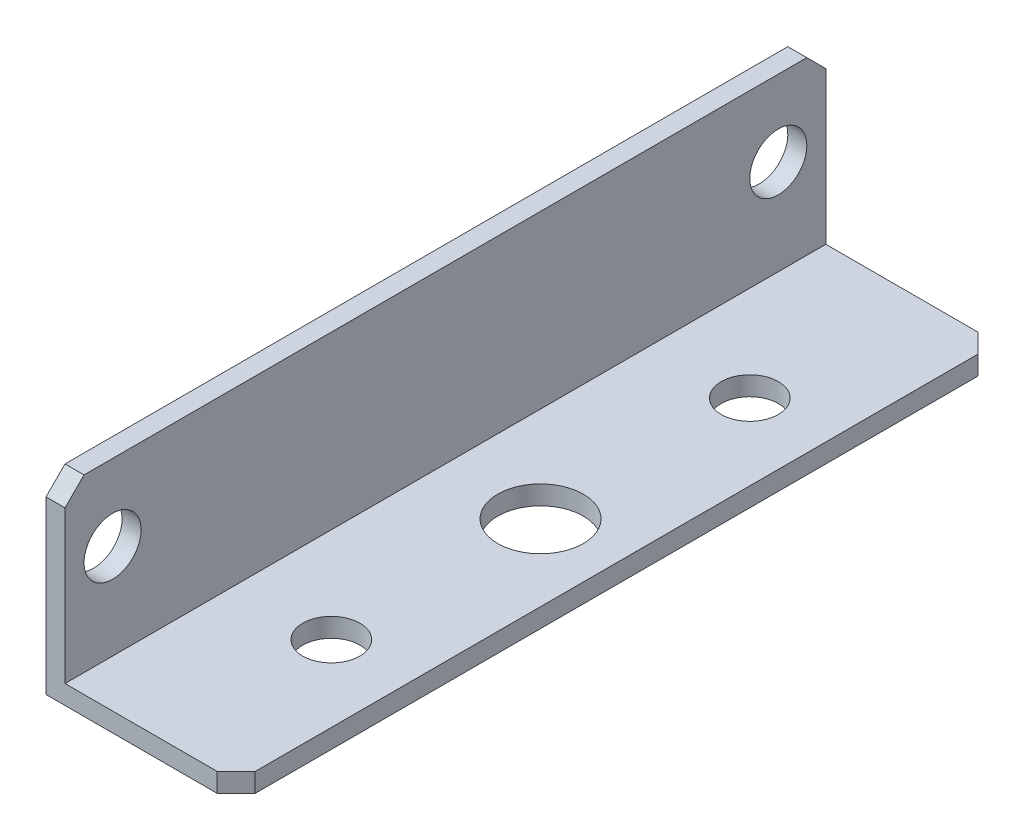
from build123d import *

# Parameters (mm, degrees)
LINEAR_AUSTRAGEN_D_NN1_DEPTH    = 20
FASE1_SIZE                      = 1
SKIZZE2_R                       = 1.5
SCHNITT_LINEAR_AUSTRAGEN1_DEPTH = 10
SKIZZE3_R                       = 1.5
SCHNITT_LINEAR_AUSTRAGEN2_DEPTH = 10
SKIZZE4_R                       = 2.25
SCHNITT_LINEAR_AUSTRAGEN3_DEPTH = 10


with BuildPart() as part:
    # Skizze1 → Linear-Austragen-Dünn1 (new, symmetric)
    with BuildSketch(Plane.XY):
        Polygon((0, 10), (0, 0), (10, 0), (10, 1), (1, 1), (1, 10), align=None)
    extrude(amount=LINEAR_AUSTRAGEN_D_NN1_DEPTH, both=True)

    # Fase1
    fase1_edges = [part.edges().sort_by_distance(p)[0] for p in [
        (0.5, 10, 20),
        (0.5, 10, -20),
        (10, 0.5, -20),
        (10, 0.5, 20),
    ]]
    chamfer(fase1_edges, length=FASE1_SIZE)

    # Skizze2 → Schnitt-Linear austragen1 (cut)
    with BuildSketch(Plane(origin=(1, 0, 0), x_dir=(0, 0, -1), z_dir=(1, 0, 0))):
        with Locations(Location((-17.5, 6, 0), (0, 0, 90))):
            Circle(SKIZZE2_R)
        with Locations(Location((17.5, 6, 0), (0, 0, 90))):
            Circle(SKIZZE2_R)
    extrude(amount=-SCHNITT_LINEAR_AUSTRAGEN1_DEPTH, mode=Mode.SUBTRACT)

    # Skizze3 → Schnitt-Linear austragen2 (cut)
    with BuildSketch(Plane(origin=(0, 1, 0), x_dir=(1, 0, 0), z_dir=(0, 1, 0))):
        with Locations(Location((6, -11, 0), (0, 0, 270))):
            Circle(SKIZZE3_R)
        with Locations(Location((6, 11, 0), (0, 0, 270))):
            Circle(SKIZZE3_R)
    extrude(amount=-SCHNITT_LINEAR_AUSTRAGEN2_DEPTH, mode=Mode.SUBTRACT)

    # Skizze4 → Schnitt-Linear austragen3 (cut)
    with BuildSketch(Plane(origin=(0, 1, 0), x_dir=(1, 0, 0), z_dir=(0, 1, 0))):
        with Locations(Location((6, 0, 0), (0, 0, 270))):
            Circle(SKIZZE4_R)
    extrude(amount=-SCHNITT_LINEAR_AUSTRAGEN3_DEPTH, mode=Mode.SUBTRACT)


solid = part.part
